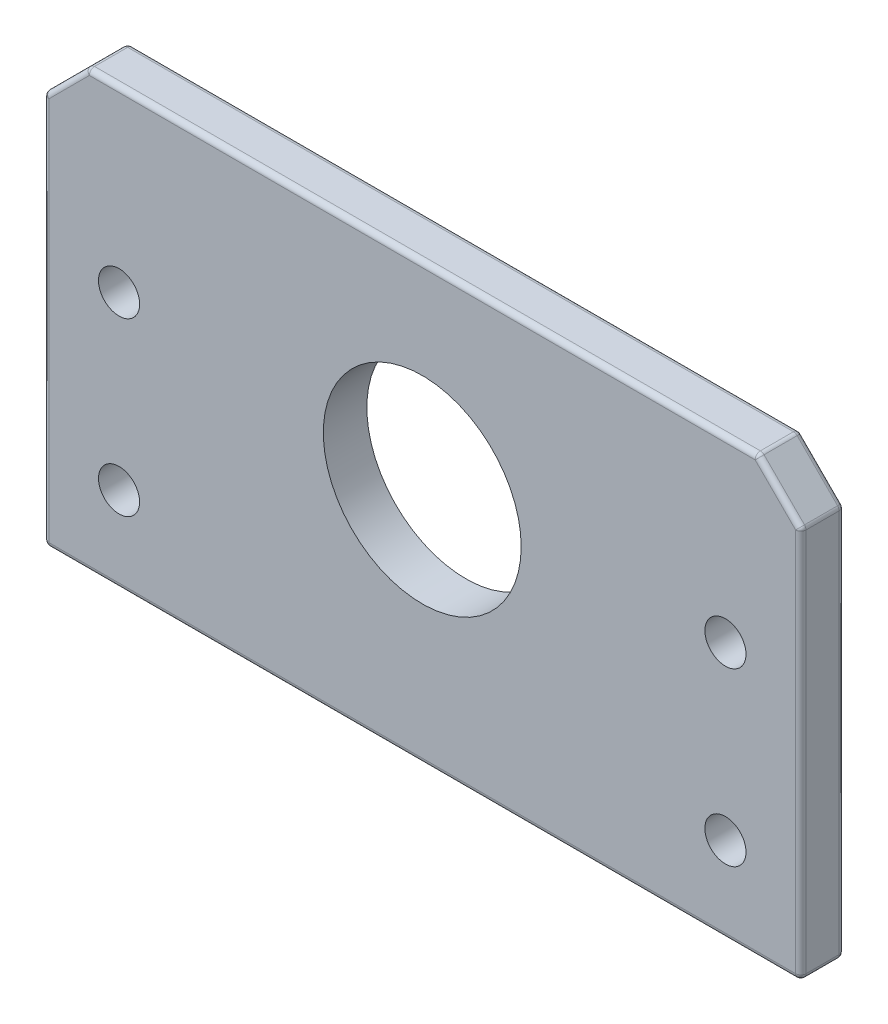
from build123d import *

# Parameters (mm, degrees)
SKETCH2_W                   = 110.49
SKETCH2_H                   = 6.35
BOSS_EXTRUDE1_DEPTH         = 63.5
SKETCH3_R                   = 14.437499981
CUT_EXTRUDE1_DEPTH          = 85.407242136
CHAMFER1_SIZE               = 6.35
TAP_DRILL_FOR_M7X1_0_TAP1_D = 6
FILLET2_R                   = 0.762


with BuildPart() as part:
    # Sketch2 → Boss-Extrude1 (new body)
    with BuildSketch(Plane(origin=(0, 0, 0), x_dir=(1, 0, 0), z_dir=(0, 1, 0))):
        Rectangle(SKETCH2_W, SKETCH2_H)
    extrude(amount=-BOSS_EXTRUDE1_DEPTH)

    # Sketch3 → Cut-Extrude1 (cut, through all)
    with BuildSketch(Plane.XY.offset(3.175)):
        with Locations((0, -28.8150046)):
            Circle(SKETCH3_R)
    extrude(amount=-CUT_EXTRUDE1_DEPTH, mode=Mode.SUBTRACT)

    # Chamfer1
    chamfer1_edges = [part.edges().sort_by_distance(p)[0] for p in [
        (55.245, 0, 0),
        (-55.245, 0, 0),
    ]]
    chamfer(chamfer1_edges, length=CHAMFER1_SIZE)

    # Tap Drill for M7x1.0 Tap1 (through all)
    with Locations(Plane(origin=(0, 0, -3.175), x_dir=(-1, 0, 0), z_dir=(0, 0, -1))):
        with Locations((44.245, -26), (44.245, -51), (-44.245, -51), (-44.245, -26)):
            Hole(TAP_DRILL_FOR_M7X1_0_TAP1_D / 2)

    # Fillet2
    fillet2_edges = [part.edges().sort_by_distance(p)[0] for p in [
        (55.245, -63.5, 0),
        (0, -63.5, -3.175),
        (0, 0, 3.175),
        (0, 0, -3.175),
        (48.895, 0, 0),
        (-48.895, 0, 0),
        (52.07, -3.175, 3.175),
        (-52.07, -3.175, 3.175),
        (-55.245, -6.35, 0),
        (52.07, -3.175, -3.175),
        (-52.07, -3.175, -3.175),
        (55.245, -6.35, 0),
        (-55.245, -63.5, 0),
        (-55.245, -34.925, -3.175),
        (55.245, -34.925, -3.175),
        (55.245, -34.925, 3.175),
        (-55.245, -34.925, 3.175),
        (0, -63.5, 3.175),
    ]]
    fillet(fillet2_edges, radius=FILLET2_R)


solid = part.part
